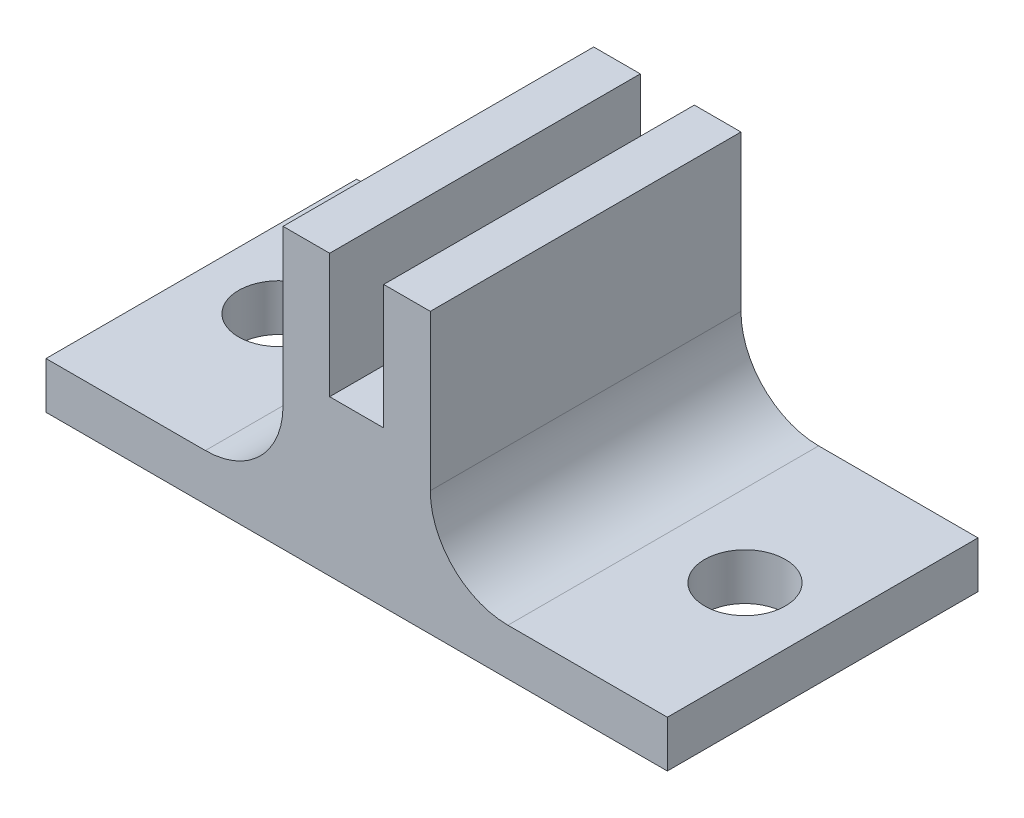
from build123d import *

# Parameters (mm, degrees)
SKETCH3_W           = 40
SKETCH3_H           = 20
SKETCH3_R           = 2.6
JIG_BASE_DEPTH      = 3
SKETCH4_W           = 3
SKETCH4_H           = 20
JIG_WALL_DEPTH      = 15
STRINGER_LOCK_DEPTH = 9.48
BASE_FILET_R        = 5


with BuildPart() as part:
    # Sketch3 → Jig base (new body)
    with BuildSketch(Plane(origin=(0, 0, 0), x_dir=(1, 0, 0), z_dir=(0, 1, 0))):
        Rectangle(SKETCH3_W, SKETCH3_H)
        with Locations(Location((-15, 0, 0), (0, 0, 270))):
            Circle(SKETCH3_R, mode=Mode.SUBTRACT)
        with Locations(Location((15, 0, 0), (0, 0, 90))):
            Circle(SKETCH3_R, mode=Mode.SUBTRACT)
    extrude(amount=JIG_BASE_DEPTH)

    # Sketch4 → jig wall (add)
    with BuildSketch(Plane(origin=(0, 3, 0), x_dir=(1, 0, 0), z_dir=(0, 1, 0))):
        with Locations((-3.24, 0)):
            Rectangle(SKETCH4_W, SKETCH4_H)
        with Locations((3.24, 0)):
            Rectangle(SKETCH4_W, SKETCH4_H)
    extrude(amount=JIG_WALL_DEPTH)

    # Sketch5 → stringer lock (add)
    with BuildSketch(Plane(origin=(4.74, 0, 0), x_dir=(0, 0, -1), z_dir=(1, 0, 0))):
        Polygon((-10, 0), (10, 0), (10, 10), (1.55, 10), (1.55, 14), (-1.55, 14), (-1.55, 10), (-10, 10), align=None)
    extrude(amount=-STRINGER_LOCK_DEPTH)

    # base filet
    base_filet_edges = [part.edges().sort_by_distance(p)[0] for p in [
        (-4.74, 3, 0),
        (4.74, 3, 0),
    ]]
    fillet(base_filet_edges, radius=BASE_FILET_R)


solid = part.part
